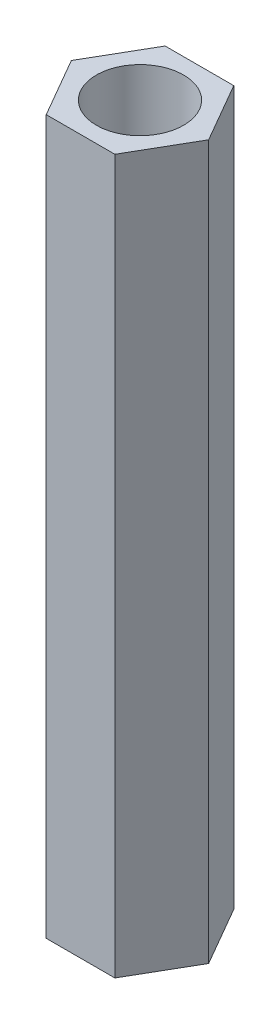
from build123d import *

# Parameters (mm, degrees)
SKETCH1_R           = 1.1
BOSS_EXTRUDE1_DEPTH = 18


with BuildPart() as part:
    # Sketch1 → Boss-Extrude1 (new body)
    with BuildSketch(Plane(origin=(0, 0, 0), x_dir=(1, 0, 0), z_dir=(0, 1, 0))):
        Polygon((0.866025404, -1.5), (1.732050808, 0), (0.866025404, 1.5), (-0.866025404, 1.5), (-1.732050808, 0), (-0.866025404, -1.5), align=None)
        with Locations(Location((0, 0, 0), (0, 0, 270))):
            Circle(SKETCH1_R, mode=Mode.SUBTRACT)
    extrude(amount=BOSS_EXTRUDE1_DEPTH)


solid = part.part
